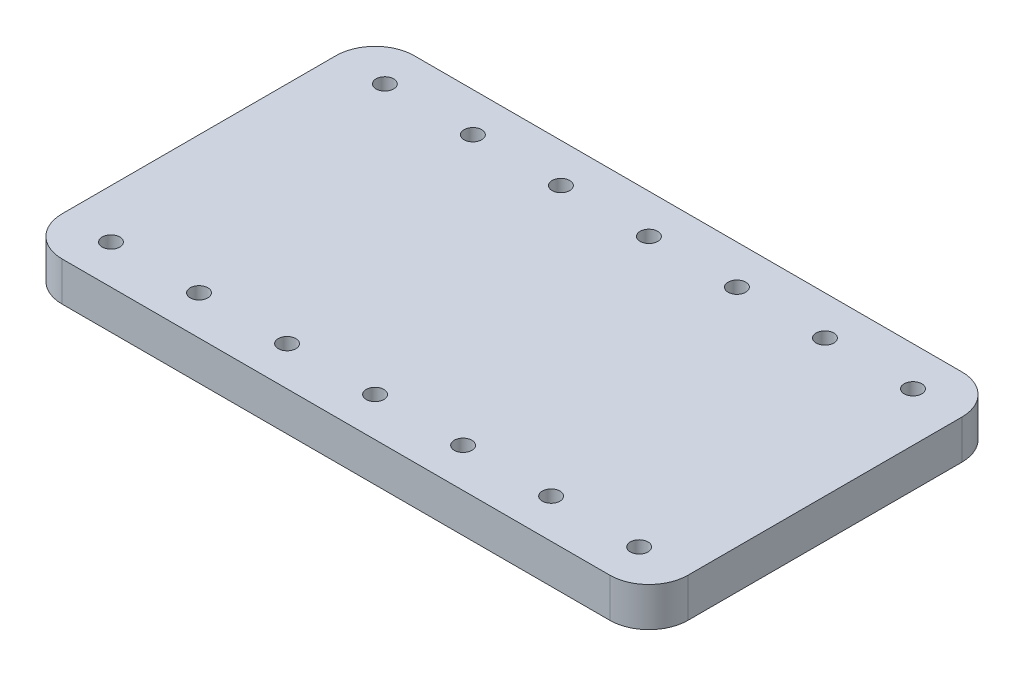
from build123d import *

# Parameters (mm, degrees)
SKETCH1_W           = 160
SKETCH1_H           = 90
SKETCH1_R           = 2.25
BOSS_EXTRUDE1_DEPTH = 10
FILLET1_R           = 10


with BuildPart() as part:
    # Sketch1 → Boss-Extrude1 (new body)
    with BuildSketch(Plane(origin=(0, 0, 0), x_dir=(1, 0, 0), z_dir=(0, 1, 0))):
        Rectangle(SKETCH1_W, SKETCH1_H)
        with Locations(Location((-67.5, 35, 0), (0, 0, 270))):
            Circle(SKETCH1_R, mode=Mode.SUBTRACT)
        with Locations(Location((-22.5, 35, 0), (0, 0, 270))):
            Circle(SKETCH1_R, mode=Mode.SUBTRACT)
        with Locations(Location((22.5, 35, 0), (0, 0, 270))):
            Circle(SKETCH1_R, mode=Mode.SUBTRACT)
        with Locations(Location((67.5, 35, 0), (0, 0, 270))):
            Circle(SKETCH1_R, mode=Mode.SUBTRACT)
        with Locations(Location((67.5, -35, 0), (0, 0, 270))):
            Circle(SKETCH1_R, mode=Mode.SUBTRACT)
        with Locations(Location((22.5, -35, 0), (0, 0, 270))):
            Circle(SKETCH1_R, mode=Mode.SUBTRACT)
        with Locations(Location((-22.5, -35, 0), (0, 0, 270))):
            Circle(SKETCH1_R, mode=Mode.SUBTRACT)
        with Locations(Location((-67.5, -35, 0), (0, 0, 270))):
            Circle(SKETCH1_R, mode=Mode.SUBTRACT)
        with Locations(Location((-45, 35, 0), (0, 0, 270))):
            Circle(SKETCH1_R, mode=Mode.SUBTRACT)
        with Locations(Location((45, 35, 0), (0, 0, 270))):
            Circle(SKETCH1_R, mode=Mode.SUBTRACT)
        with Locations(Location((0, 35, 0), (0, 0, 270))):
            Circle(SKETCH1_R, mode=Mode.SUBTRACT)
        with Locations(Location((-45, -35, 0), (0, 0, 270))):
            Circle(SKETCH1_R, mode=Mode.SUBTRACT)
        with Locations(Location((0, -35, 0), (0, 0, 270))):
            Circle(SKETCH1_R, mode=Mode.SUBTRACT)
        with Locations(Location((45, -35, 0), (0, 0, 270))):
            Circle(SKETCH1_R, mode=Mode.SUBTRACT)
    extrude(amount=BOSS_EXTRUDE1_DEPTH)

    # Fillet1
    fillet1_edges = [part.edges().sort_by_distance(p)[0] for p in [
        (-80, 5, -45),
        (80, 5, -45),
        (80, 5, 45),
        (-80, 5, 45),
    ]]
    fillet(fillet1_edges, radius=FILLET1_R)


solid = part.part
